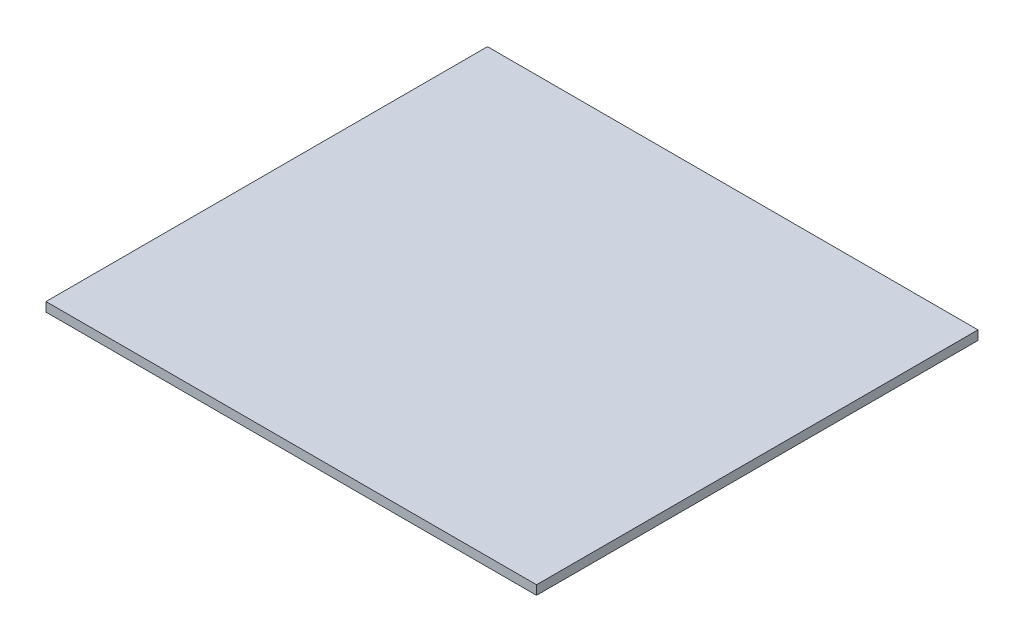
from build123d import *

# Parameters (mm, degrees)
SKETCH1_W           = 1016
SKETCH1_H           = 914.4
BOSS_EXTRUDE1_DEPTH = 19.05


with BuildPart() as part:
    # Sketch1 → Boss-Extrude1 (new body)
    with BuildSketch(Plane(origin=(0, 0, 0), x_dir=(1, 0, 0), z_dir=(0, 1, 0))):
        with Locations((508, 457.2)):
            Rectangle(SKETCH1_W, SKETCH1_H)
    extrude(amount=BOSS_EXTRUDE1_DEPTH)


solid = part.part
